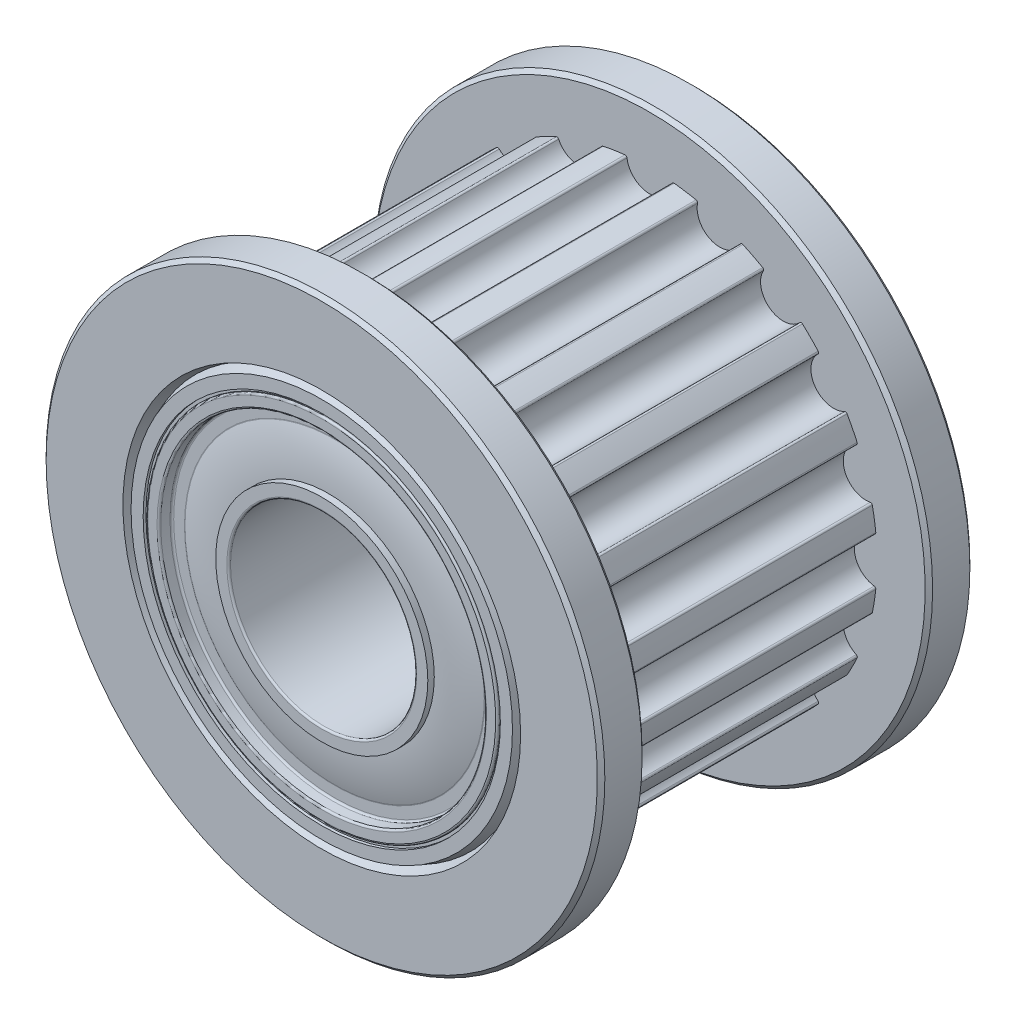
from build123d import *

# Parameters (mm, degrees)
CUT_EXTRUDE1_REACH             = 13.726
CUT_EXTRUDE1_DIRECTION_2_REACH = 13.726
FILLET1_R                      = 0.05
CIRPATTERN3_COUNT              = 20
FILLET1_OF_CIRPATTERN3_R       = 0.05
CHAMFER1_SIZE                  = 0.1
FILLET2_R                      = 0.05


with BuildPart() as part:
    # Sketch2 → Revolve1 (revolve)
    with BuildSketch(Plane(origin=(0, 0, 0), x_dir=(0, 0, -1), z_dir=(1, 0, 0))):
        with BuildLine():
            Line((5, 2.5), (0, 2.5))
            Line((0, 2.5), (0, 4.72))
            Line((0, 4.72), (5, 4.72))
            Line((5, 4.72), (5, 4.3725))
            Line((5, 4.3725), (4.6525, 4.3725))
            Line((4.6525, 4.3725), (4.6525, 4.025))
            ThreePointArc((4.6525, 4.025), (4.782578593, 3.442625053), (4.82625, 2.8475))
            Line((4.82625, 2.8475), (5, 2.8475))
            Line((5, 2.8475), (5, 2.5))
        make_face()
    revolve(axis=Axis((0, 0, 5), (0, 0, -1)))

    # Mirror1: part across plane


with BuildPart() as part_1:
    add(part.part)
    add(part.part.mirror(Plane.XY))

    # Fillet2
    fillet2_edges = [part_1.edges().sort_by_distance(p)[0] for p in [
        (0, -4.025, 4.6525),
        (0, -4.3725, 4.6525),
        (0, -4.72, 5),
        (0, -4.3725, 5),
        (0, -2.5, 5),
        (0, -2.5, -5),
        (0, -4.72, -5),
        (0, -4.025, -4.6525),
        (0, -4.3725, -5),
        (0, -2.8475, -5),
    ]]
    fillet(fillet2_edges, radius=FILLET2_R)


with BuildPart() as body_2:
    # Sketch3 → Revolve2 (revolve)
    with BuildSketch(Plane(origin=(0, 0, 0), x_dir=(0, 0, -1), z_dir=(1, 0, 0))):
        Polygon((3.8, 7.5), (5, 7.5), (5, 5.338382141), (4.7, 5.22919107), (5, 5.12), (5, 4.795), (4.925, 4.795), (4.925, 4.72), (-4.925, 4.72), (-4.925, 4.795), (-5, 4.795), (-5, 5.12), (-4.7, 5.22919107), (-5, 5.338382141), (-5, 7.5), (-3.8, 7.5), (-3.8, 6.11), (3.8, 6.11), align=None)
    revolve(axis=Axis((0, 0, 5), (0, 0, -1)))

    # Cut-Extrude1: up to this face of the body (flat: up to its plane)
    cut_extrude1_end = Plane(body_2.part.faces().sort_by_distance((0, -6.322132034, -3.8))[0])
    # Sketch4 → Cut-Extrude1 (cut, up to the picked face)
    with BuildSketch(Plane.XY, mode=Mode.PRIVATE) as cut_extrude1_sk1:
        with BuildLine():
            Line((-0.611, 6.11), (0.611, 6.11))
            ThreePointArc((0.611, 6.11), (0, 5.499), (-0.611, 6.11))
        make_face()
    cut_extrude1_tool1 = split(extrude(cut_extrude1_sk1.sketch, amount=-CUT_EXTRUDE1_REACH, mode=Mode.PRIVATE), bisect_by=cut_extrude1_end, keep=Keep.BOTH, mode=Mode.PRIVATE)
    cut_extrude1 = cut_extrude1_tool1.solids().sort_by(Axis((0, 5.850684, 0), (0, 0, -1)))[0]
    add(cut_extrude1, mode=Mode.SUBTRACT)

    # Cut-Extrude1 direction 2: up to this face of the body (flat: up to its plane)
    cut_extrude1_direction_2_end = Plane(body_2.part.faces().sort_by_distance((0, -7.287867966, 3.8))[0])
    # Sketch4 → Cut-Extrude1 direction 2 (cut, up to the picked face)
    with BuildSketch(Plane.XY, mode=Mode.PRIVATE) as cut_extrude1_direction_2_sk1:
        with BuildLine():
            Line((-0.611, 6.11), (0.611, 6.11))
            ThreePointArc((0.611, 6.11), (0, 5.499), (-0.611, 6.11))
        make_face()
    cut_extrude1_direction_2_tool1 = split(extrude(cut_extrude1_direction_2_sk1.sketch, amount=CUT_EXTRUDE1_DIRECTION_2_REACH, mode=Mode.PRIVATE), bisect_by=cut_extrude1_direction_2_end, keep=Keep.BOTH, mode=Mode.PRIVATE)
    cut_extrude1_direction_2 = cut_extrude1_direction_2_tool1.solids().sort_by(Axis((0, 5.850684, 0), (0, 0, 1)))[0]
    add(cut_extrude1_direction_2, mode=Mode.SUBTRACT)

    # Fillet1
    fillet1_edges = [body_2.edges().sort_by_distance(p)[0] for p in [
        (0.610235772, 6.07945, 0),
        (-0.610235772, 6.07945, 0),
    ]]
    fillet(fillet1_edges, radius=FILLET1_R)

    # CirPattern3: Cut-Extrude1, Cut-Extrude1 direction 2 ×20 about axis
    cirpattern3_axis = Axis((0, 0, -3.8), (0, 0, 1))
    add([cut_extrude1.rotate(cirpattern3_axis, i * 360 / CIRPATTERN3_COUNT) for i in range(1, CIRPATTERN3_COUNT)], mode=Mode.SUBTRACT)
    add([cut_extrude1_direction_2.rotate(cirpattern3_axis, i * 360 / CIRPATTERN3_COUNT) for i in range(1, CIRPATTERN3_COUNT)], mode=Mode.SUBTRACT)

    # Fillet1 of CirPattern3
    fillet1_of_cirpattern3_edges = [body_2.edges().sort_by_distance(p)[0] for p in [
        (-1.298284659, 5.970473762, 0),
        (-2.459022074, 5.593327314, 0),
        (-3.079719942, 5.277065954, 0),
        (-4.067102162, 4.559690779, 0),
        (-4.559690779, 4.067102162, 0),
        (-5.277065954, 3.079719942, 0),
        (-5.593327314, 2.459022074, 0),
        (-5.970473762, 1.298284659, 0),
        (-6.07945, 0.610235772, 0),
        (-6.07945, -0.610235772, 0),
        (-5.970473762, -1.298284659, 0),
        (-5.593327314, -2.459022074, 0),
        (-5.277065954, -3.079719942, 0),
        (-4.559690779, -4.067102162, 0),
        (-4.067102162, -4.559690779, 0),
        (-3.079719942, -5.277065954, 0),
        (-2.459022074, -5.593327314, 0),
        (-1.298284659, -5.970473762, 0),
        (-0.610235772, -6.07945, 0),
        (0.610235772, -6.07945, 0),
        (1.298284659, -5.970473762, 0),
        (2.459022074, -5.593327314, 0),
        (3.079719942, -5.277065954, 0),
        (4.067102162, -4.559690779, 0),
        (4.559690779, -4.067102162, 0),
        (5.277065954, -3.079719942, 0),
        (5.593327314, -2.459022074, 0),
        (5.970473762, -1.298284659, 0),
        (6.07945, -0.610235772, 0),
        (6.07945, 0.610235772, 0),
        (5.970473762, 1.298284659, 0),
        (5.593327314, 2.459022074, 0),
        (5.277065954, 3.079719942, 0),
        (4.559690779, 4.067102162, 0),
        (4.067102162, 4.559690779, 0),
        (3.079719942, 5.277065954, 0),
        (2.459022074, 5.593327314, 0),
        (1.298284659, 5.970473762, 0),
    ]]
    fillet(fillet1_of_cirpattern3_edges, radius=FILLET1_OF_CIRPATTERN3_R)

    # Chamfer1
    chamfer1_edges = [body_2.edges().sort_by_distance(p)[0] for p in [
        (0, -7.5, -5),
        (0, -7.5, -3.8),
        (0, -7.5, 3.8),
        (0, -7.5, 5),
    ]]
    chamfer(chamfer1_edges, length=CHAMFER1_SIZE)

    # Combine1: union part
    add(part_1.part)


solid = body_2.part
